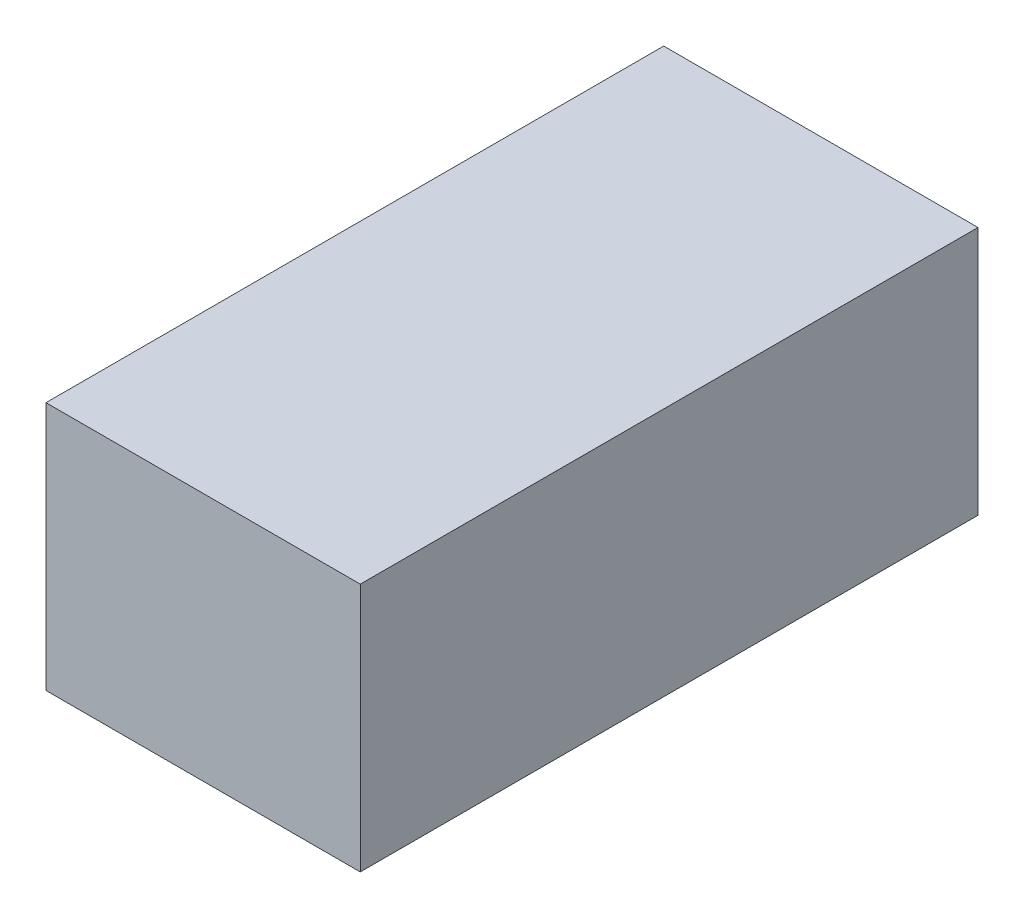
from build123d import *

# Parameters (mm, degrees)
SKETCH_1_W      = 29
SKETCH_1_H      = 23
EXTRUDE_1_DEPTH = 57


with BuildPart() as part:
    # 草图1 → 凸台-拉伸1 (new body)
    with BuildSketch(Plane.XY):
        Rectangle(SKETCH_1_W, SKETCH_1_H)
    extrude(amount=EXTRUDE_1_DEPTH)


solid = part.part
